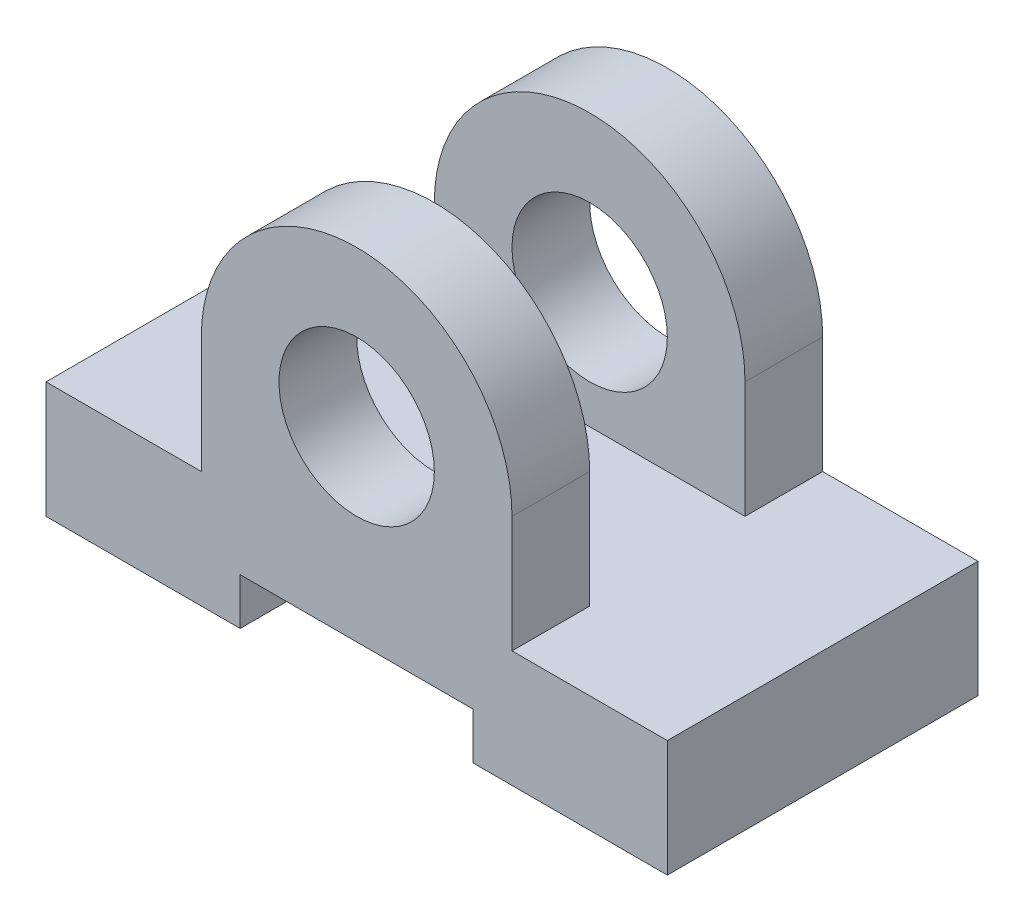
from build123d import *

# Parameters (mm, degrees)
ESBO_O1_R                  = 10
RESSALTO_EXTRUS_O1_DEPTH   = 40
CORTE_EXTRUS_O1_DEPTH      = 79.102496759
CORTE_EXTRUS_O1_DEPTH_BACK = 79.102496759
ESBO_O2_W                  = 20
ESBO_O2_H                  = 35


with BuildPart() as part:
    # Esboço1 → Ressalto-extrusão1 (new body)
    with BuildSketch(Plane.XY):
        with BuildLine():
            Line((15, -30), (15, -24))
            Line((15, -24), (-15, -24))
            Line((-15, -24), (-15, -30))
            Line((-15, -30), (-40, -30))
            Line((-40, -30), (-40, -15))
            Line((-40, -15), (-20, -15))
            Line((-20, -15), (-20, 0))
            ThreePointArc((-20, 0), (0, 20), (20, 0))
            Line((20, 0), (20, -15))
            Line((20, -15), (40, -15))
            Line((40, -15), (40, -30))
            Line((40, -30), (15, -30))
        make_face()
        Circle(ESBO_O1_R, mode=Mode.SUBTRACT)
    extrude(amount=-RESSALTO_EXTRUS_O1_DEPTH)

    # Esboço2 → Corte-extrusão1 (cut, two sides: drawn at the far end of the back side and taken through both)
    with BuildSketch(Plane.ZY.offset(20).offset(-CORTE_EXTRUS_O1_DEPTH_BACK)):
        with Locations((-20, 2.5)):
            Rectangle(ESBO_O2_W, ESBO_O2_H)
    extrude(amount=CORTE_EXTRUS_O1_DEPTH + CORTE_EXTRUS_O1_DEPTH_BACK, mode=Mode.SUBTRACT)


solid = part.part
